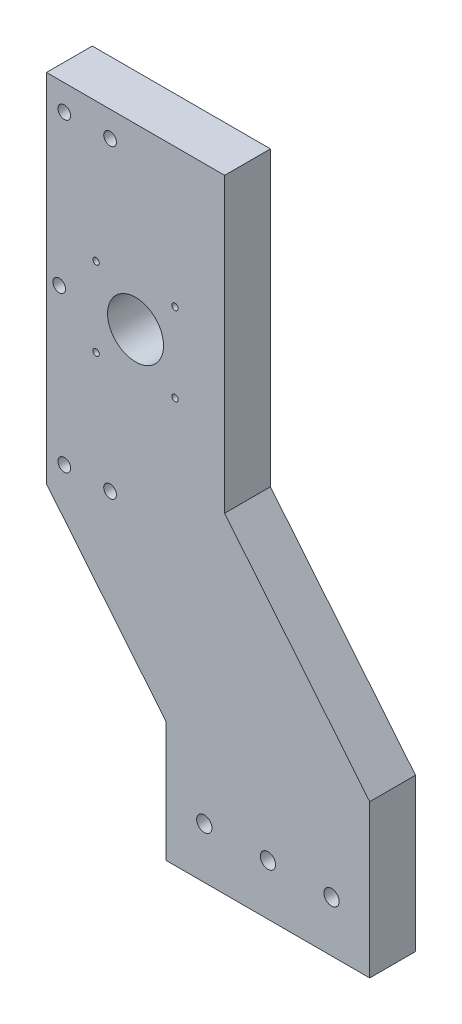
from build123d import *

# Parameters (mm, degrees)
EXTRUDE_1_DEPTH     = 18
HOLE_WIZARD_M6_1_D  = 5
SKETCH_6_R          = 3
CUT_EXTRUDE_1_DEPTH = 259.015029546
SKETCH_7_R          = 11
SKETCH_7_R_2        = 1.25
CUT_EXTRUDE_2_DEPTH = 259.015029546


with BuildPart() as part:
    # 草图1 → 凸台-拉伸1 (new body)
    with BuildSketch(Plane.XY):
        Polygon((0, 0), (80, 0), (80, 60), (22.986425339, 129.63800905), (22.986425339, 244.63800905), (-47.013574661, 244.63800905), (-47.013574661, 104.63800905), (0, 47.214285714), align=None)
    extrude(amount=EXTRUDE_1_DEPTH)

    # M6 螺纹孔1 (through all)
    with Locations(Plane.XY.offset(18)):
        with Locations((-40.013574661, 114.63800905), (-22.013574661, 114.63800905), (-40.013574661, 234.63800905), (-22.013574661, 234.63800905), (-42.013574661, 174.63800905)):
            Hole(HOLE_WIZARD_M6_1_D / 2)

    # 草图6 → 切除-拉伸1 (cut, through all)
    with BuildSketch(Plane.XY.offset(18)):
        with Locations((15, 20)):
            Circle(SKETCH_6_R)
        with Locations((65, 20)):
            Circle(SKETCH_6_R)
        with Locations((40, 20)):
            Circle(SKETCH_6_R)
    extrude(amount=-CUT_EXTRUDE_1_DEPTH, mode=Mode.SUBTRACT)

    # 草图7 → 切除-拉伸2 (cut, through all)
    with BuildSketch(Plane.XY.offset(18)):
        with Locations((-12.013574661, 174.63800905)):
            Circle(SKETCH_7_R)
        with Locations((-27.513574661, 190.13800905)):
            Circle(SKETCH_7_R_2)
        with Locations(Location((3.486425339, 190.13800905, 0), (0, 0, 180))):
            Circle(SKETCH_7_R_2)
        with Locations((3.486425339, 159.13800905)):
            Circle(SKETCH_7_R_2)
        with Locations(Location((-27.513574661, 159.13800905, 0), (0, 0, 180))):
            Circle(SKETCH_7_R_2)
    extrude(amount=-CUT_EXTRUDE_2_DEPTH, mode=Mode.SUBTRACT)


solid = part.part
